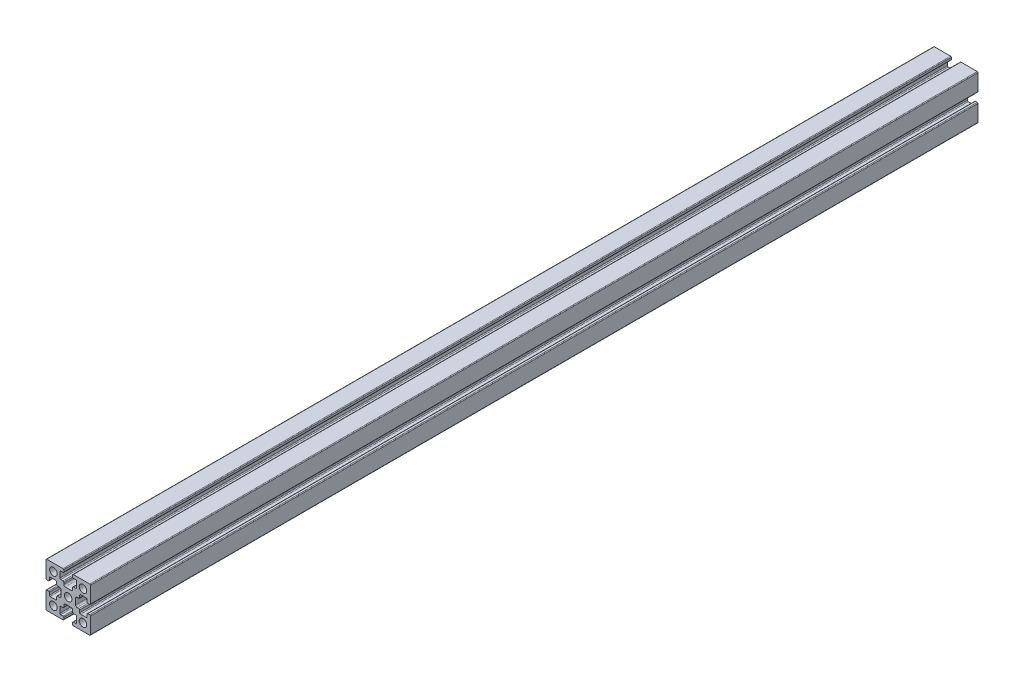
from build123d import *

# Parameters (mm, degrees)
SKETCH1_R           = 1.275
BOSS_EXTRUDE1_DEPTH = 150
FILLET2_R           = 0.5
FILLET3_R           = 0.3
FILLET1_R           = 0.25
CIRPATTERN1_COUNT   = 4


with BuildPart() as part:
    # Sketch1 → Boss-Extrude1 (new, symmetric)
    with BuildSketch(Plane.XY):
        with BuildLine():
            Line((1.5, -7.5), (7.25, -7.5))
            ThreePointArc((7.25, -7.5), (7.426776695, -7.426776695), (7.5, -7.25))
            Line((7.5, -7.25), (7.5, -1.5))
            Line((7.5, -1.5), (6.4, -1.5))
            Line((6.4, -1.5), (6.4, -2.85))
            Line((6.4, -2.85), (3.9, -2.85))
            Line((3.9, -2.85), (3.9, -1.5))
            Line((3.9, -1.5), (2.5, -1.5))
            Line((2.5, -1.5), (2.5, 0))
            Line((2.5, 0), (1.275, 0))
            ThreePointArc((1.275, 0), (0.901561146, -0.901561146), (0, -1.275))
            Line((0, -1.275), (0, -2.5))
            Line((0, -2.5), (1.5, -2.5))
            Line((1.5, -2.5), (1.5, -3.9))
            Line((1.5, -3.9), (2.85, -3.9))
            Line((2.85, -3.9), (2.85, -6.4))
            Line((2.85, -6.4), (1.5, -6.4))
            Line((1.5, -6.4), (1.5, -7.5))
        make_face()
        with Locations((5, -5)):
            Circle(SKETCH1_R, mode=Mode.SUBTRACT)
    extrude(amount=BOSS_EXTRUDE1_DEPTH, both=True)

    # Fillet2
    fillet2_edges = [part.edges().sort_by_distance(p)[0] for p in [
        (2.5, -1.5, 0),
        (1.5, -2.5, 0),
    ]]
    fillet(fillet2_edges, radius=FILLET2_R)

    # Fillet3
    fillet3_edges = [part.edges().sort_by_distance(p)[0] for p in [
        (3.9, -1.5, 0),
        (3.9, -2.85, 0),
        (6.4, -2.85, 0),
        (2.85, -6.4, 0),
        (2.85, -3.9, 0),
        (1.5, -3.9, 0),
    ]]
    fillet(fillet3_edges, radius=FILLET3_R)

    # Fillet1
    fillet1_edges = [part.edges().sort_by_distance(p)[0] for p in [
        (6.4, -1.5, 0),
        (7.5, -1.5, 0),
        (1.5, -7.5, 0),
        (1.5, -6.4, 0),
    ]]
    fillet(fillet1_edges, radius=FILLET1_R)


with BuildPart() as cirpattern1_1:
    # CirPattern1: pattern copy
    add(part.part.rotate(Axis((0, 0, 0), (0, 0, 1)), 1 * 360 / CIRPATTERN1_COUNT))


with BuildPart() as cirpattern1_2:
    # CirPattern1: pattern copy
    add(part.part.rotate(Axis((0, 0, 0), (0, 0, 1)), 2 * 360 / CIRPATTERN1_COUNT))


with BuildPart() as cirpattern1_3:
    # CirPattern1: pattern copy
    add(part.part.rotate(Axis((0, 0, 0), (0, 0, 1)), 3 * 360 / CIRPATTERN1_COUNT))


with BuildPart() as part_1:
    add(part.part)

    # Combine1: union CirPattern1_1, CirPattern1_2, CirPattern1_3
    add(cirpattern1_1.part)
    add(cirpattern1_2.part)
    add(cirpattern1_3.part)


solid = part_1.part
